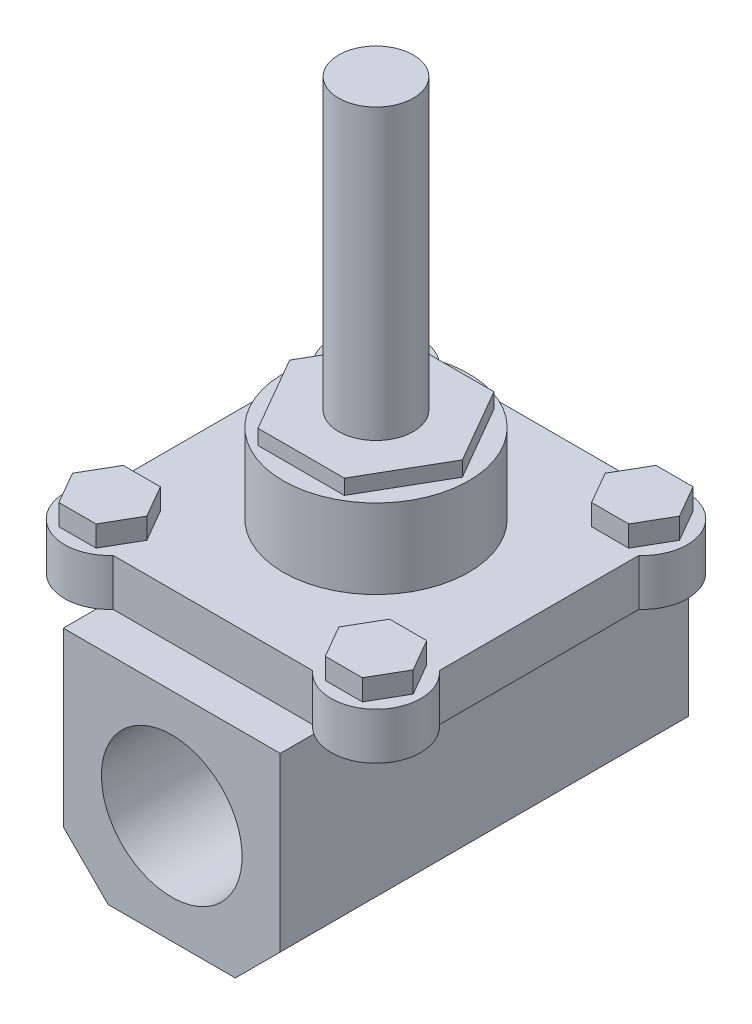
from build123d import *

# Parameters (mm, degrees)
BOSS_EXTRUDE1_DEPTH      = 7.9375
BOSS_EXTRUDE2_DEPTH      = 6.985
BOSS_EXTRUDE2_DEPTH_BACK = 62.357
SKETCH2_W                = 36.83
SKETCH2_H                = 36.83
SKETCH3_R                = 11.938
CUT_EXTRUDE1_DEPTH       = 85.133066864
BOSS_EXTRUDE3_DEPTH      = 3.556
SKETCH7_R                = 15.748
BOSS_EXTRUDE4_DEPTH      = 13.462
BOSS_EXTRUDE5_DEPTH      = 2.54
SKETCH9_R                = 6.35
BOSS_EXTRUDE6_DEPTH      = 49.022
CHAMFER1_SIZE            = 7.62


with BuildPart() as part:
    # Sketch1 → Boss-Extrude1 (new body)
    with BuildSketch(Plane(origin=(0, 0, 0), x_dir=(1, 0, 0), z_dir=(0, 1, 0))):
        with BuildLine():
            Line((16.926387337, 27.686), (-16.926387337, 27.686))
            ThreePointArc((-16.926387337, 27.686), (-27.994153673, 27.994153673), (-27.686, 16.926387337))
            Line((-27.686, 16.926387337), (-27.686, -16.926387337))
            ThreePointArc((-27.686, -16.926387337), (-27.994153673, -27.994153673), (-16.926387337, -27.686))
            Line((-16.926387337, -27.686), (16.926387337, -27.686))
            ThreePointArc((16.926387337, -27.686), (27.994153673, -27.994153673), (27.686, -16.926387337))
            Line((27.686, -16.926387337), (27.686, 16.926387337))
            ThreePointArc((27.686, 16.926387337), (27.994153673, 27.994153673), (16.926387337, 27.686))
        make_face()
    extrude(amount=BOSS_EXTRUDE1_DEPTH)

    # Sketch6 → Boss-Extrude3 (add)
    with BuildSketch(Plane(origin=(0, 7.9375, 0), x_dir=(1, 0, 0), z_dir=(0, 1, 0))):
        Polygon((16.30018036, -22.606), (19.45309018, -28.067), (25.75890982, -28.067), (28.91181964, -22.606), (25.75890982, -17.145), (19.45309018, -17.145), align=None)
        Polygon((-16.30018036, -22.606), (-19.45309018, -17.145), (-25.75890982, -17.145), (-28.91181964, -22.606), (-25.75890982, -28.067), (-19.45309018, -28.067), align=None)
        Polygon((-16.30018036, 22.606), (-19.45309018, 28.067), (-25.75890982, 28.067), (-28.91181964, 22.606), (-25.75890982, 17.145), (-19.45309018, 17.145), align=None)
        Polygon((16.30018036, 22.606), (19.45309018, 17.145), (25.75890982, 17.145), (28.91181964, 22.606), (25.75890982, 28.067), (19.45309018, 28.067), align=None)
    extrude(amount=BOSS_EXTRUDE3_DEPTH)

    # Sketch7 → Boss-Extrude4 (add)
    with BuildSketch(Plane(origin=(0, 7.9375, 0), x_dir=(1, 0, 0), z_dir=(0, 1, 0))):
        with Locations(Location((0, 0, 0), (0, 0, 270))):
            Circle(SKETCH7_R)
    extrude(amount=BOSS_EXTRUDE4_DEPTH)

    # Sketch8 → Boss-Extrude5 (add)
    with BuildSketch(Plane(origin=(0, 21.3995, 0), x_dir=(1, 0, 0), z_dir=(0, 1, 0))):
        Polygon((14.664696837, 0), (7.332348419, 12.7), (-7.332348419, 12.7), (-14.664696837, 0), (-7.332348419, -12.7), (7.332348419, -12.7), align=None)
    extrude(amount=BOSS_EXTRUDE5_DEPTH)

    # Sketch9 → Boss-Extrude6 (add)
    with BuildSketch(Plane(origin=(0, 23.9395, 0), x_dir=(1, 0, 0), z_dir=(0, 1, 0))):
        with Locations(Location((0, 0, 0), (0, 0, 270))):
            Circle(SKETCH9_R)
    extrude(amount=BOSS_EXTRUDE6_DEPTH)


with BuildPart() as body_2:
    # Sketch2 → Boss-Extrude2 (new, two sides: drawn at the far end of the back side and taken through both)
    with BuildSketch(Plane.XY.offset(27.686).offset(-BOSS_EXTRUDE2_DEPTH_BACK)):
        with Locations((0, -18.415)):
            Rectangle(SKETCH2_W, SKETCH2_H)
    extrude(amount=BOSS_EXTRUDE2_DEPTH + BOSS_EXTRUDE2_DEPTH_BACK)

    # Sketch3 → Cut-Extrude1 (cut, through all)
    with BuildSketch(Plane(origin=(0, 0, -34.671), x_dir=(-1, 0, 0), z_dir=(0, 0, -1))):
        with Locations((0, -18.415)):
            Circle(SKETCH3_R)
    extrude(amount=-CUT_EXTRUDE1_DEPTH, mode=Mode.SUBTRACT)

    # Chamfer1
    chamfer1_edges = [body_2.edges().sort_by_distance(p)[0] for p in [
        (18.415, -36.83, 0),
        (-18.415, -36.83, 0),
    ]]
    chamfer(chamfer1_edges, length=CHAMFER1_SIZE)


solid = Compound([part.part, body_2.part])
